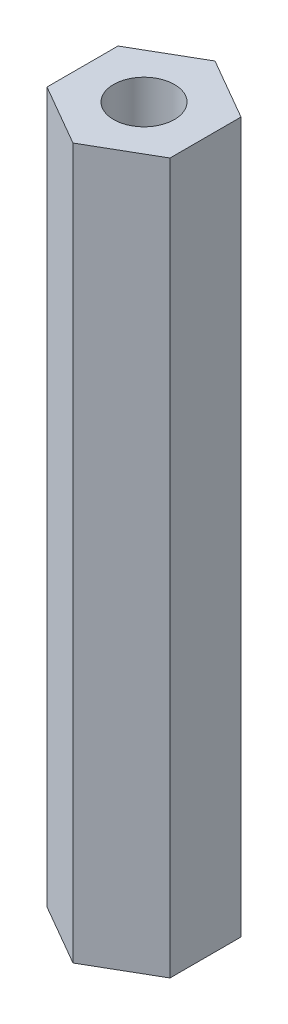
from build123d import *

# Parameters (mm, degrees)
SKETCH_1_R      = 1.5
EXTRUDE_1_DEPTH = 35


with BuildPart() as part:
    # 草图1 → 凸台-拉伸1 (new body)
    with BuildSketch(Plane(origin=(0, 0, 0), x_dir=(1, 0, 0), z_dir=(0, 1, 0))):
        Polygon((0, 3.5), (-3.031088913, 1.75), (-3.031088913, -1.75), (0, -3.5), (3.031088913, -1.75), (3.031088913, 1.75), align=None)
        with Locations(Location((0, 0, 0), (0, 0, 270))):
            Circle(SKETCH_1_R, mode=Mode.SUBTRACT)
    extrude(amount=EXTRUDE_1_DEPTH)


solid = part.part
